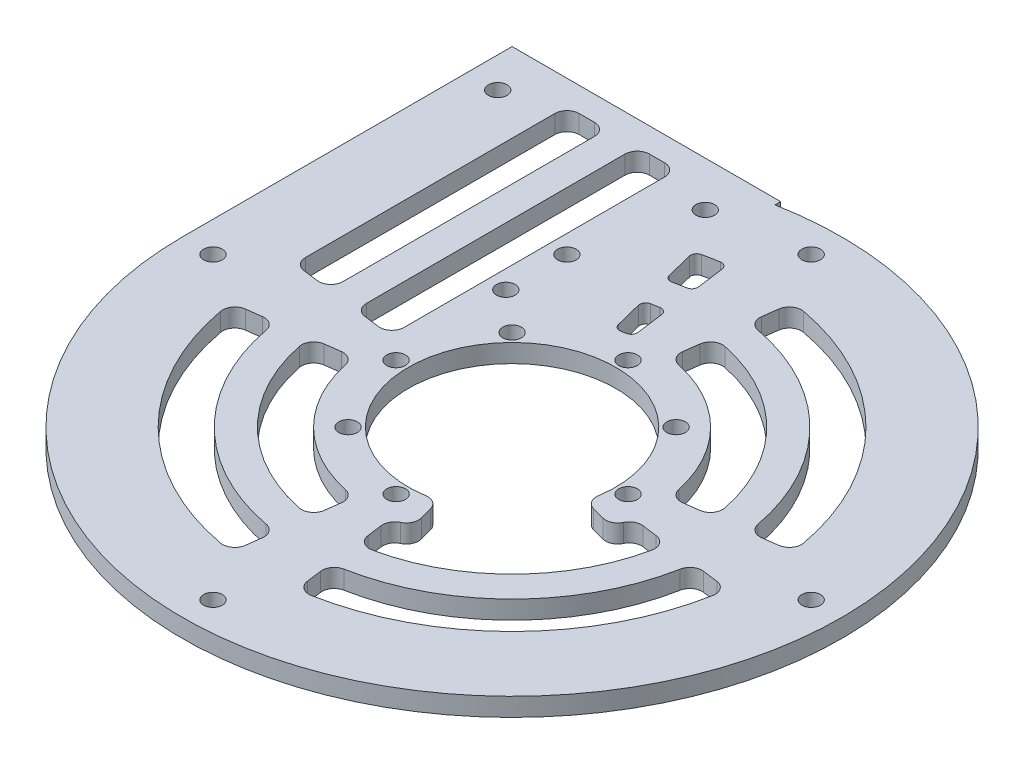
from build123d import *

# Parameters (mm, degrees)
SKETCH_1_R          = 1.525
SKETCH_1_R_2        = 17
EXTRUDE_1_DEPTH     = 3
CUT_EXTRUDE_2_DEPTH = 77.426435217
CUT_EXTRUDE_3_DEPTH = 77.426435217
FILLET_1_R          = 2


with BuildPart() as part:
    # 草图1 → 凸台-拉伸1 (new body)
    with BuildSketch(Plane(origin=(0, 0, 0), x_dir=(1, 0, 0), z_dir=(0, 1, 0))):
        with BuildLine():
            Line((-54, 0), (-54, 54))
            Line((-54, 54), (-10, 54))
            Line((-10, 54), (-10, 53.065996646))
            ThreePointArc((-10, 53.065996646), (41.569219382, -34.467375879), (-54, 0))
        make_face()
        with Locations(Location((-15, 46.647615159, 0), (0, 0, 270))):
            Circle(SKETCH_1_R, mode=Mode.SUBTRACT)
        with Locations(Location((0, 49, 0), (0, 0, 270))):
            Circle(SKETCH_1_R, mode=Mode.SUBTRACT)
        with Locations(Location((49, 0, 0), (0, 0, 270))):
            Circle(SKETCH_1_R, mode=Mode.SUBTRACT)
        with Locations(Location((0, -49, 0), (0, 0, 270))):
            Circle(SKETCH_1_R, mode=Mode.SUBTRACT)
        with Locations(Location((-49, 0, 0), (0, 0, 270))):
            Circle(SKETCH_1_R, mode=Mode.SUBTRACT)
        with Locations(Location((0, 0, 0), (0, 0, 270))):
            Circle(SKETCH_1_R_2, mode=Mode.SUBTRACT)
        with Locations(Location((0, 19, 0), (0, 0, 270))):
            Circle(SKETCH_1_R, mode=Mode.SUBTRACT)
        with Locations(Location((13.435028843, 13.435028843, 0), (0, 0, 270))):
            Circle(SKETCH_1_R, mode=Mode.SUBTRACT)
        with Locations(Location((19, 0, 0), (0, 0, 270))):
            Circle(SKETCH_1_R, mode=Mode.SUBTRACT)
        with Locations(Location((13.435028843, -13.435028843, 0), (0, 0, 270))):
            Circle(SKETCH_1_R, mode=Mode.SUBTRACT)
        with Locations(Location((0, -19, 0), (0, 0, 270))):
            Circle(SKETCH_1_R, mode=Mode.SUBTRACT)
        with Locations(Location((-13.435028843, -13.435028843, 0), (0, 0, 270))):
            Circle(SKETCH_1_R, mode=Mode.SUBTRACT)
        with Locations(Location((-19, 0, 0), (0, 0, 270))):
            Circle(SKETCH_1_R, mode=Mode.SUBTRACT)
        with Locations(Location((-13.435028843, 13.435028843, 0), (0, 0, 270))):
            Circle(SKETCH_1_R, mode=Mode.SUBTRACT)
        with Locations(Location((-49, 46.647615159, 0), (0, 0, 270))):
            Circle(SKETCH_1_R, mode=Mode.SUBTRACT)
        with Locations(Location((-20, 28.979991994, 0), (0, 0, 270))):
            Circle(SKETCH_1_R, mode=Mode.SUBTRACT)
        with Locations(Location((-20, 18.979991994, 0), (0, 0, 270))):
            Circle(SKETCH_1_R, mode=Mode.SUBTRACT)
    extrude(amount=EXTRUDE_1_DEPTH)

    # 草图2 → 切除-拉伸2 (cut, through all)
    with BuildSketch(Plane(origin=(0, 0, 0), x_dir=(1, 0, 0), z_dir=(0, 1, 0))):
        with BuildLine():
            Line((-41, 7.151705327), (-41, 48))
            ThreePointArc((-41, 48), (-40.414213562, 49.414213562), (-39, 50))
            Line((-39, 50), (-36.5, 50))
            ThreePointArc((-36.5, 50), (-35.085786438, 49.414213562), (-34.5, 48))
            Line((-34.5, 48), (-34.5, 6.822574083))
            ThreePointArc((-34.5, 6.822574083), (-35.18130837, 5.318894468), (-36.761052384, 4.83968436))
            Line((-36.761052384, 4.83968436), (-39.261052384, 5.168815604))
            ThreePointArc((-39.261052384, 5.168815604), (-40.503679615, 5.833013697), (-41, 7.151705327))
        make_face()
        with BuildLine():
            Line((-23, 48), (-23, 5.308570361))
            ThreePointArc((-23, 5.308570361), (-23.68130837, 3.804890746), (-25.261052384, 3.325680638))
            Line((-25.261052384, 3.325680638), (-27.761052384, 3.654811882))
            ThreePointArc((-27.761052384, 3.654811882), (-29.003679615, 4.319009975), (-29.5, 5.637701605))
            Line((-29.5, 5.637701605), (-29.5, 48))
            ThreePointArc((-29.5, 48), (-28.914213562, 49.414213562), (-27.5, 50))
            Line((-27.5, 50), (-25, 50))
            ThreePointArc((-25, 50), (-23.585786438, 49.414213562), (-23, 48))
        make_face()
        with BuildLine():
            Line((-9.753048304, 38.779866539), (-8.655100658, 34.414230089))
            ThreePointArc((-8.655100658, 34.414230089), (-8.210625652, 33.807230719), (-7.468813536, 33.681847104))
            ThreePointArc((-7.468813536, 33.681847104), (-6.469677057, 33.887951823), (-5.464883503, 34.064424967))
            ThreePointArc((-5.464883503, 34.064424967), (-4.821436337, 34.45427367), (-4.631841062, 35.182325795))
            Line((-4.631841062, 35.182325795), (-5.219415856, 39.645399457))
            ThreePointArc((-5.219415856, 39.645399457), (-5.612064549, 40.315774725), (-6.366132236, 40.502745097))
            ThreePointArc((-6.366132236, 40.502745097), (-7.68860172, 40.272638399), (-9.002829744, 39.999363202))
            ThreePointArc((-9.002829744, 39.999363202), (-9.634981946, 39.547744349), (-9.753048304, 38.779866539))
        make_face()
        with BuildLine():
            Line((-3.71770584, 28.238779423), (-3.129908136, 23.774012599))
            ThreePointArc((-3.129908136, 23.774012599), (-3.315486635, 23.051388943), (-3.949629956, 22.65834114))
            ThreePointArc((-3.949629956, 22.65834114), (-4.313118038, 22.591967882), (-4.675492953, 22.51976389))
            ThreePointArc((-4.675492953, 22.51976389), (-5.409834137, 22.65154914), (-5.848575028, 23.25498162))
            Line((-5.848575028, 23.25498162), (-6.946939204, 27.622274267))
            ThreePointArc((-6.946939204, 27.622274267), (-6.82621795, 28.39444337), (-6.186863621, 28.843937292))
            ThreePointArc((-6.186863621, 28.843937292), (-5.532042701, 28.976654458), (-4.874384059, 29.09450773))
            ThreePointArc((-4.874384059, 29.09450773), (-4.114403615, 28.912166101), (-3.71770584, 28.238779423))
        make_face()
        with BuildLine():
            Line((5.083823439, 38.615472796), (4.757048519, 36.133370856))
            ThreePointArc((4.757048519, 36.133370856), (5.120458294, 34.698740737), (6.370626558, 33.90671198))
            ThreePointArc((6.370626558, 33.90671198), (24.395183951, 24.395183951), (33.90671198, 6.370626558))
            ThreePointArc((33.90671198, 6.370626558), (34.698740737, 5.120458294), (36.133370856, 4.757048519))
            Line((36.133370856, 4.757048519), (38.615472796, 5.083823439))
            ThreePointArc((38.615472796, 5.083823439), (39.971833872, 5.890289047), (40.321313766, 7.429108709))
            ThreePointArc((40.321313766, 7.429108709), (28.991378029, 28.991378029), (7.429108709, 40.321313766))
            ThreePointArc((7.429108709, 40.321313766), (5.890289047, 39.971833872), (5.083823439, 38.615472796))
        make_face()
        with BuildLine():
            Line((3.579964886, 27.192533008), (3.252695949, 24.706678633))
            ThreePointArc((3.252695949, 24.706678633), (3.601410919, 23.292598548), (4.816738818, 22.489976148))
            ThreePointArc((4.816738818, 22.489976148), (16.263455967, 16.263455967), (22.489976148, 4.816738818))
            ThreePointArc((22.489976148, 4.816738818), (23.292598548, 3.601410919), (24.706678633, 3.252695949))
            Line((24.706678633, 3.252695949), (27.192533008, 3.579964886))
            ThreePointArc((27.192533008, 3.579964886), (28.561439402, 4.40387472), (28.89013376, 5.967425853))
            ThreePointArc((28.89013376, 5.967425853), (20.859650045, 20.859650045), (5.967425853, 28.89013376))
            ThreePointArc((5.967425853, 28.89013376), (4.40387472, 28.561439402), (3.579964886, 27.192533008))
        make_face()
        with BuildLine():
            Line((38.615472796, -5.083823439), (36.133370856, -4.757048519))
            ThreePointArc((36.133370856, -4.757048519), (34.698740737, -5.120458294), (33.90671198, -6.370626558))
            ThreePointArc((33.90671198, -6.370626558), (24.395183951, -24.395183951), (6.370626558, -33.90671198))
            ThreePointArc((6.370626558, -33.90671198), (5.120458294, -34.698740737), (4.757048519, -36.133370856))
            Line((4.757048519, -36.133370856), (5.083823439, -38.615472796))
            ThreePointArc((5.083823439, -38.615472796), (5.890289047, -39.971833872), (7.429108709, -40.321313766))
            ThreePointArc((7.429108709, -40.321313766), (28.991378029, -28.991378029), (40.321313766, -7.429108709))
            ThreePointArc((40.321313766, -7.429108709), (39.971833872, -5.890289047), (38.615472796, -5.083823439))
        make_face()
        with BuildLine():
            Line((27.192533008, -3.579964886), (24.706678633, -3.252695949))
            ThreePointArc((24.706678633, -3.252695949), (23.292598548, -3.601410919), (22.489976148, -4.816738818))
            ThreePointArc((22.489976148, -4.816738818), (16.263455967, -16.263455967), (4.816738818, -22.489976148))
            ThreePointArc((4.816738818, -22.489976148), (3.601410919, -23.292598548), (3.252695949, -24.706678633))
            Line((3.252695949, -24.706678633), (3.579964886, -27.192533008))
            ThreePointArc((3.579964886, -27.192533008), (4.40387472, -28.561439402), (5.967425853, -28.89013376))
            ThreePointArc((5.967425853, -28.89013376), (20.859650045, -20.859650045), (28.89013376, -5.967425853))
            ThreePointArc((28.89013376, -5.967425853), (28.561439402, -4.40387472), (27.192533008, -3.579964886))
        make_face()
        with BuildLine():
            Line((-5.083823439, -38.615472796), (-4.757048519, -36.133370856))
            ThreePointArc((-4.757048519, -36.133370856), (-5.120458294, -34.698740737), (-6.370626558, -33.90671198))
            ThreePointArc((-6.370626558, -33.90671198), (-24.395183951, -24.395183951), (-33.90671198, -6.370626558))
            ThreePointArc((-33.90671198, -6.370626558), (-34.698740737, -5.120458294), (-36.133370856, -4.757048519))
            Line((-36.133370856, -4.757048519), (-38.615472796, -5.083823439))
            ThreePointArc((-38.615472796, -5.083823439), (-39.971833872, -5.890289047), (-40.321313766, -7.429108709))
            ThreePointArc((-40.321313766, -7.429108709), (-28.991378029, -28.991378029), (-7.429108709, -40.321313766))
            ThreePointArc((-7.429108709, -40.321313766), (-5.890289047, -39.971833872), (-5.083823439, -38.615472796))
        make_face()
        with BuildLine():
            Line((-3.579964886, -27.192533008), (-3.252695949, -24.706678633))
            ThreePointArc((-3.252695949, -24.706678633), (-3.601410919, -23.292598548), (-4.816738818, -22.489976148))
            ThreePointArc((-4.816738818, -22.489976148), (-16.263455967, -16.263455967), (-22.489976148, -4.816738818))
            ThreePointArc((-22.489976148, -4.816738818), (-23.292598548, -3.601410919), (-24.706678633, -3.252695949))
            Line((-24.706678633, -3.252695949), (-27.192533008, -3.579964886))
            ThreePointArc((-27.192533008, -3.579964886), (-28.561439402, -4.40387472), (-28.89013376, -5.967425853))
            ThreePointArc((-28.89013376, -5.967425853), (-20.859650045, -20.859650045), (-5.967425853, -28.89013376))
            ThreePointArc((-5.967425853, -28.89013376), (-4.40387472, -28.561439402), (-3.579964886, -27.192533008))
        make_face()
    extrude(amount=CUT_EXTRUDE_2_DEPTH, mode=Mode.SUBTRACT)

    # 草图3 → 切除-拉伸3 (cut, through all)
    with BuildSketch(Plane(origin=(0, 3, 0), x_dir=(1, 0, 0), z_dir=(0, 1, 0))):
        with BuildLine():
            Line((0, 0), (5.952838037, -22.216294005))
            ThreePointArc((5.952838037, -22.216294005), (16.263455967, -16.263455967), (22.216294005, -5.952838037))
            Line((22.216294005, -5.952838037), (0, 0))
        make_face()
    extrude(amount=-CUT_EXTRUDE_3_DEPTH, mode=Mode.SUBTRACT)

    # 圆角1
    fillet_1_edges = [part.edges().sort_by_distance(p)[0] for p in [
        (5.952838037, 1.5, 22.216294005),
        (4.399923767, 1.5, 16.420739047),
        (16.420739047, 1.5, 4.399923767),
        (22.216294005, 1.5, 5.952838037),
    ]]
    fillet(fillet_1_edges, radius=FILLET_1_R)


solid = part.part
